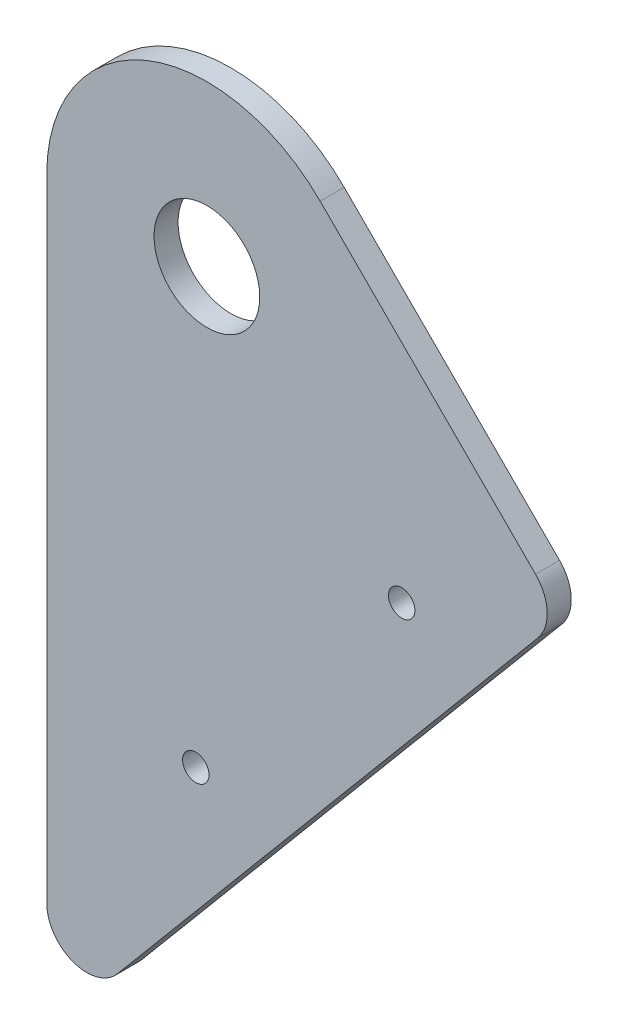
from build123d import *

# Parameters (mm, degrees)
SKETCH_1_R      = 6.6
SKETCH_1_R_2    = 1.65
EXTRUDE_1_DEPTH = 3
FILLET_1_R      = 5


with BuildPart() as part:
    # 草图1 → 凸台-拉伸1 (new body)
    with BuildSketch(Plane.XY):
        with BuildLine():
            Line((0, 0), (64.278760969, 76.604444312))
            Line((64.278760969, 76.604444312), (34.142135624, 106.741069657))
            ThreePointArc((34.142135624, 106.741069657), (12.346331353, 111.076524683), (0, 92.598934033))
            Line((0, 92.598934033), (0, 0))
        make_face()
        with Locations((20, 92.598934033)):
            Circle(SKETCH_1_R, mode=Mode.SUBTRACT)
        with Locations((18.613426245, 37.739855867)):
            Circle(SKETCH_1_R_2, mode=Mode.SUBTRACT)
        with Locations((44.324930633, 68.381633592)):
            Circle(SKETCH_1_R_2, mode=Mode.SUBTRACT)
    extrude(amount=EXTRUDE_1_DEPTH)

    # 圆角1
    fillet_1_edges = [part.edges().sort_by_distance(p)[0] for p in [
        (64.278760969, 76.604444312, 1.5),
        (0, 0, 1.5),
    ]]
    fillet(fillet_1_edges, radius=FILLET_1_R)


solid = part.part
